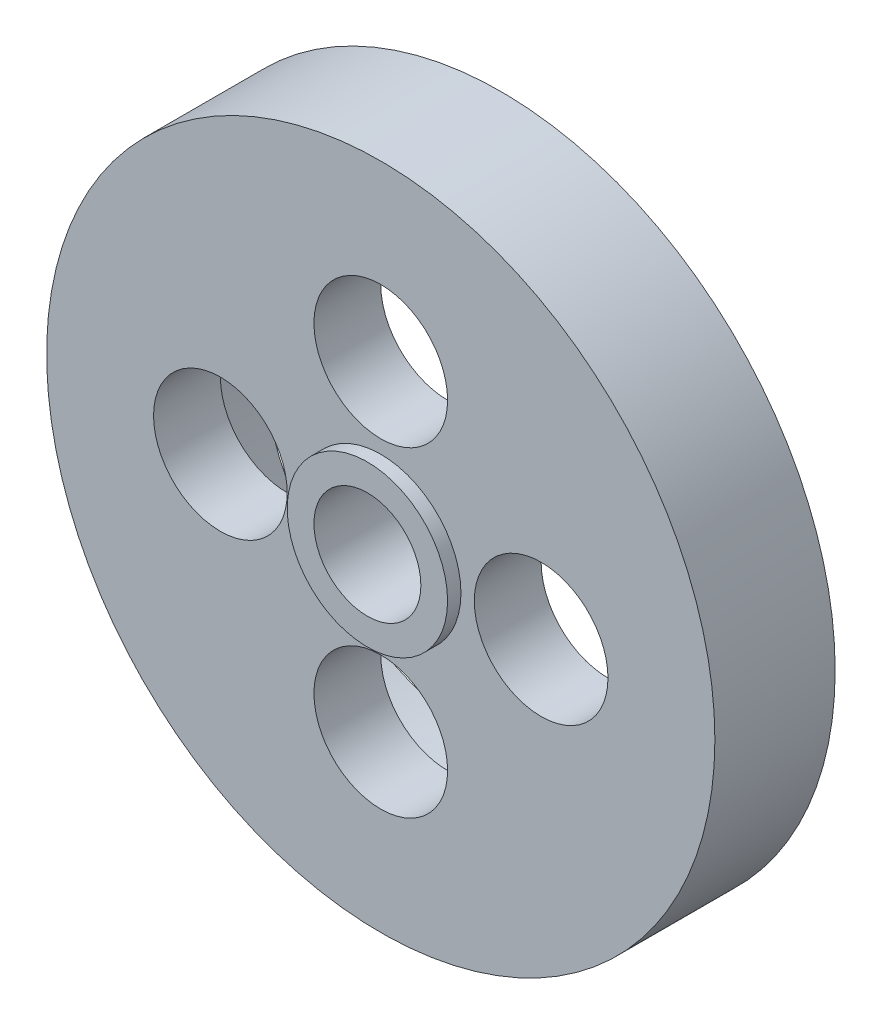
from build123d import *

# Parameters (mm, degrees)
SKETCH1_R           = 25
SKETCH1_R_2         = 5
SKETCH1_R_3         = 4
BOSS_EXTRUDE1_DEPTH = 9
SKETCH2_R           = 18
CUT_EXTRUDE1_DEPTH  = 4
SKETCH3_R           = 6
SKETCH3_R_2         = 4
BOSS_EXTRUDE2_DEPTH = 1


with BuildPart() as part:
    # Sketch1 → Boss-Extrude1 (new body)
    with BuildSketch(Plane.XY):
        Circle(SKETCH1_R)
        with Locations((0, 12)):
            Circle(SKETCH1_R_2, mode=Mode.SUBTRACT)
        with Locations((12, 0)):
            Circle(SKETCH1_R_2, mode=Mode.SUBTRACT)
        with Locations((0, -12)):
            Circle(SKETCH1_R_2, mode=Mode.SUBTRACT)
        with Locations((-12, 0)):
            Circle(SKETCH1_R_2, mode=Mode.SUBTRACT)
        Circle(SKETCH1_R_3, mode=Mode.SUBTRACT)
    extrude(amount=BOSS_EXTRUDE1_DEPTH)

    # Sketch2 → Cut-Extrude1 (cut)
    with BuildSketch(Plane(origin=(0, 0, 0), x_dir=(-1, 0, 0), z_dir=(0, 0, -1))):
        Circle(SKETCH2_R)
    extrude(amount=-CUT_EXTRUDE1_DEPTH, mode=Mode.SUBTRACT)

    # Sketch3 → Boss-Extrude2 (add)
    with BuildSketch(Plane.XY.offset(9)):
        Circle(SKETCH3_R)
        with Locations(Location((0, 0, 0), (0, 0, 180))):
            Circle(SKETCH3_R_2, mode=Mode.SUBTRACT)
    extrude(amount=BOSS_EXTRUDE2_DEPTH)


solid = part.part
